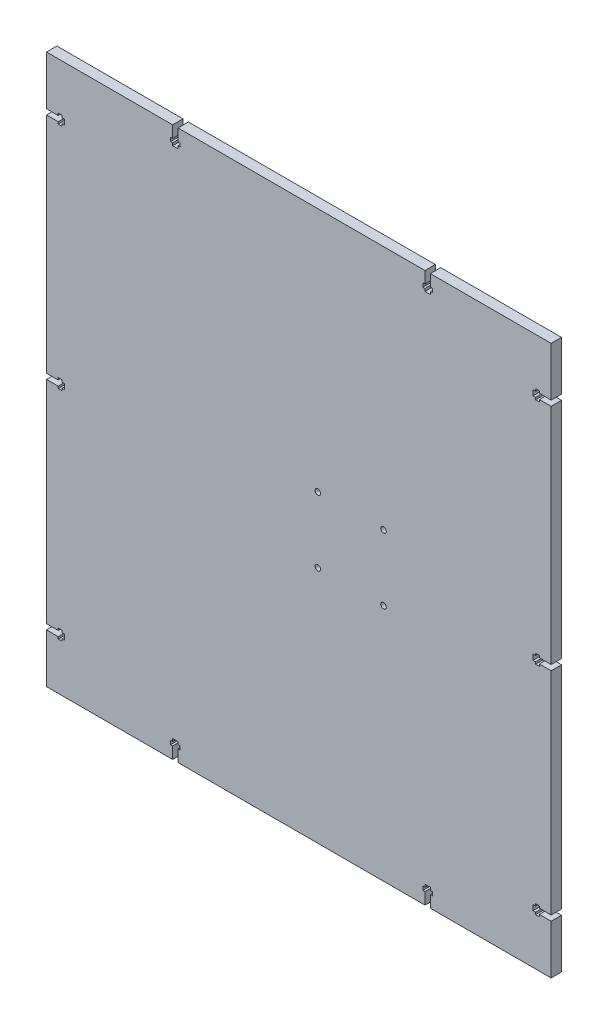
from build123d import *

# Parameters (mm, degrees)
SKETCH_1_R      = 1.6
EXTRUDE_1_DEPTH = 6


with BuildPart() as part:
    # Эскиз1 → Бобышка-Вытянуть1 (new body)
    with BuildSketch(Plane.XY):
        Polygon((0, 0), (73, 0), (73, -6.8), (71.8, -6.8), (71.8, -9), (73, -9), (73, -10.5), (76.1, -10.5), (76.1, -9), (77.3, -9), (77.3, -6.8), (76.1, -6.8), (76.1, 0), (219, 0), (219, -6.8), (217.8, -6.8), (217.8, -9), (219, -9), (219, -10.5), (222.1, -10.5), (222.1, -9), (223.3, -9), (223.3, -6.8), (222.1, -6.8), (222.1, 0), (292, 0), (292, -28.45), (285.2, -28.45), (285.2, -27.25), (283, -27.25), (283, -28.45), (281.5, -28.45), (281.5, -31.55), (283, -31.55), (283, -32.75), (285.2, -32.75), (285.2, -31.55), (292, -31.55), (292, -33.1), (292, -160.95), (285.2, -160.95), (285.2, -159.75), (283, -159.75), (283, -160.95), (281.5, -160.95), (281.5, -164.05), (283, -164.05), (283, -165.25), (285.2, -165.25), (285.2, -164.05), (292, -164.05), (292, -286.45), (285.2, -286.45), (285.2, -285.25), (283, -285.25), (283, -286.45), (281.5, -286.45), (281.5, -289.55), (283, -289.55), (283, -290.75), (285.2, -290.75), (285.2, -289.55), (292, -289.55), (292, -318), (222.1, -318), (222.1, -311.2), (223.3, -311.2), (223.3, -309), (222.1, -309), (222.1, -307.5), (219, -307.5), (219, -309), (217.8, -309), (217.8, -311.2), (219, -311.2), (219, -318), (76.1, -318), (76.1, -311.2), (77.3, -311.2), (77.3, -309), (76.1, -309), (76.1, -307.5), (73, -307.5), (73, -309), (71.8, -309), (71.8, -311.2), (73, -311.2), (73, -318), (0, -318), (0, -289.55), (6.8, -289.55), (6.8, -290.75), (9, -290.75), (9, -289.55), (10.5, -289.55), (10.5, -286.45), (9, -286.45), (9, -285.25), (6.8, -285.25), (6.8, -286.45), (0, -286.45), (0, -164.05), (6.8, -164.05), (6.8, -165.25), (9, -165.25), (9, -164.05), (10.5, -164.05), (10.5, -160.95), (9, -160.95), (9, -159.75), (6.8, -159.75), (6.8, -160.95), (0, -160.95), (0, -31.55), (6.8, -31.55), (6.8, -32.75), (9, -32.75), (9, -31.55), (10.5, -31.55), (10.5, -28.45), (9, -28.45), (9, -27.25), (6.8, -27.25), (6.8, -28.45), (0, -28.45), align=None)
        with Locations(Location((157, -141.95, 0), (0, 0, 180))):
            Circle(SKETCH_1_R, mode=Mode.SUBTRACT)
        with Locations((195, -141.95)):
            Circle(SKETCH_1_R, mode=Mode.SUBTRACT)
        with Locations(Location((195, -179.95, 0), (0, 0, 180))):
            Circle(SKETCH_1_R, mode=Mode.SUBTRACT)
        with Locations((157, -179.95)):
            Circle(SKETCH_1_R, mode=Mode.SUBTRACT)
    extrude(amount=EXTRUDE_1_DEPTH)


solid = part.part
